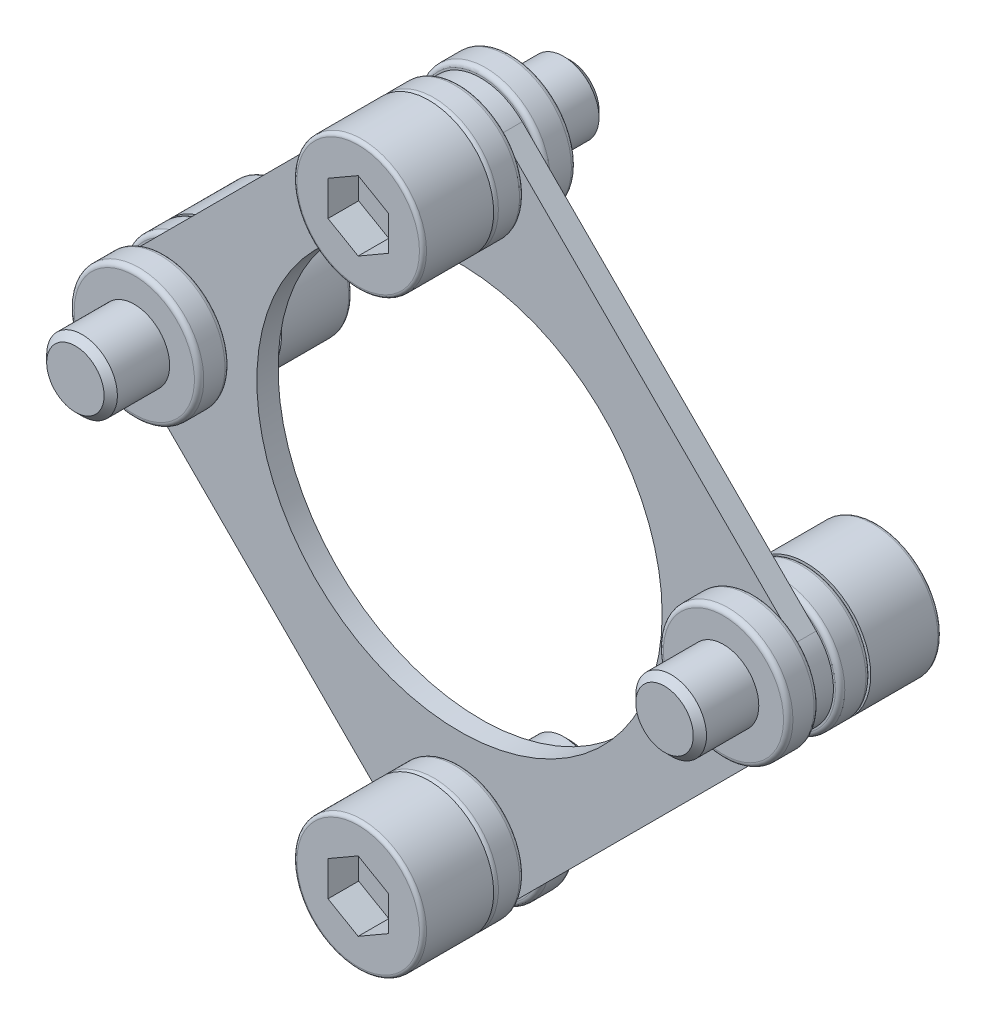
from build123d import *

# Parameters (mm, degrees)
SKETCH1_R           = 16
SKETCH1_R_2         = 8.6
BOSS_EXTRUDE1_DEPTH = 0.9
SKETCH7_OUTSIDE_W   = 43.052
SKETCH7_OUTSIDE_H   = 43.052
CUT_EXTRUDE14_DEPTH = 23.645308565
CUT_EXTRUDE1_DEPTH  = 1.3
CUT_EXTRUDE2_DEPTH  = 1.3
CIRPATTERN1_COUNT   = 2


with BuildPart() as part:
    # Sketch1 → Boss-Extrude1 (new body)
    with BuildSketch(Plane.XY):
        Circle(SKETCH1_R)
        Circle(SKETCH1_R_2, mode=Mode.SUBTRACT)
    extrude(amount=BOSS_EXTRUDE1_DEPTH)

    # Sketch7 outside → Cut-Extrude14 (cut, through all)
    with BuildSketch(Plane.XY):
        Rectangle(SKETCH7_OUTSIDE_W, SKETCH7_OUTSIDE_H)
        with BuildLine():
            Line((-1.761402992, 14.238302146), (-14.238302146, 1.761402992))
            ThreePointArc((-14.238302146, 1.761402992), (-14.967899154, 0), (-14.238302146, -1.761402992))
            Line((-14.238302146, -1.761402992), (-1.761402992, -14.238302146))
            ThreePointArc((-1.761402992, -14.238302146), (0, -14.967899154), (1.761402992, -14.238302146))
            Line((1.761402992, -14.238302146), (14.238302146, -1.761402992))
            ThreePointArc((14.238302146, -1.761402992), (14.967899154, 0), (14.238302146, 1.761402992))
            Line((14.238302146, 1.761402992), (1.761402992, 14.238302146))
            ThreePointArc((1.761402992, 14.238302146), (0, 14.967899154), (-1.761402992, 14.238302146))
        make_face(mode=Mode.SUBTRACT)
    extrude(amount=CUT_EXTRUDE14_DEPTH, mode=Mode.SUBTRACT)

    # Sketch2 → Revolve1 (revolve)
    with BuildSketch(Plane.ZY, mode=Mode.PRIVATE) as revolve1_sk:
        with BuildLine():
            Line((5.2, 12.5), (5.2, 15.1))
            ThreePointArc((5.2, 15.1), (5.156066017, 15.206066017), (5.05, 15.25))
            Line((5.05, 15.25), (2.2, 15.25))
            Line((2.2, 15.25), (2.2, 15.05))
            ThreePointArc((2.2, 15.05), (2.141421356, 15.191421356), (2, 15.25))
            Line((2, 15.25), (1.1, 15.25))
            ThreePointArc((1.1, 15.25), (0.958578644, 15.191421356), (0.9, 15.05))
            Line((0.9, 15.05), (0.9, 12.5))
            Line((0.9, 12.5), (5.2, 12.5))
        make_face()
        with BuildLine():
            Line((-3.519, 14), (-3.8, 13.719))
            Line((-3.8, 13.719), (-3.8, 12.5))
            Line((-3.8, 12.5), (0, 12.5))
            Line((0, 12.5), (0, 15.05))
            ThreePointArc((0, 15.05), (-0.058578644, 15.191421356), (-0.2, 15.25))
            Line((-0.2, 15.25), (-1.1, 15.25))
            ThreePointArc((-1.1, 15.25), (-1.241421356, 15.191421356), (-1.3, 15.05))
            Line((-1.3, 15.05), (-1.3, 14))
            Line((-1.3, 14), (-3.519, 14))
        make_face()
    revolve1 = revolve(revolve1_sk.sketch.rotate(Axis((0, 12.5, 5.2), (0, 0, -1)), 90), axis=Axis((0, 12.5, 5.2), (0, 0, -1)))

    # Sketch3 → Cut-Extrude1 (cut)
    with BuildSketch(Plane.XY.offset(5.2)):
        Polygon((0, 13.978016689), (-1.28, 13.239008345), (-1.28, 11.760991655), (0, 11.021983311), (1.28, 11.760991655), (1.28, 13.239008345), align=None)
    cut_extrude1 = extrude(amount=-CUT_EXTRUDE1_DEPTH, mode=Mode.SUBTRACT)

    # Sketch4 → Revolve2 (revolve)
    with BuildSketch(Plane(origin=(0, 0, 0), x_dir=(0, 0, 1), z_dir=(0, -1, 0))):
        with BuildLine():
            Line((-4.3, 12.5), (-4.3, 15.1))
            ThreePointArc((-4.3, 15.1), (-4.256066017, 15.206066017), (-4.15, 15.25))
            Line((-4.15, 15.25), (-1.3, 15.25))
            Line((-1.3, 15.25), (-1.3, 15.05))
            ThreePointArc((-1.3, 15.05), (-1.241421356, 15.191421356), (-1.1, 15.25))
            Line((-1.1, 15.25), (-0.2, 15.25))
            ThreePointArc((-0.2, 15.25), (-0.058578644, 15.191421356), (0, 15.05))
            Line((0, 15.05), (0, 12.5))
            Line((0, 12.5), (-4.3, 12.5))
        make_face()
        with BuildLine():
            Line((4.7, 12.5), (0.9, 12.5))
            Line((0.9, 12.5), (0.9, 15.05))
            ThreePointArc((0.9, 15.05), (0.958578644, 15.191421356), (1.1, 15.25))
            Line((1.1, 15.25), (2, 15.25))
            ThreePointArc((2, 15.25), (2.141421356, 15.191421356), (2.2, 15.05))
            Line((2.2, 15.05), (2.2, 14))
            Line((2.2, 14), (4.419, 14))
            Line((4.419, 14), (4.7, 13.719))
            Line((4.7, 13.719), (4.7, 12.5))
        make_face()
    revolve2 = revolve(axis=Axis((-12.5, 0, -4.3), (0, 0, 1)))

    # Sketch5 → Cut-Extrude2 (cut)
    with BuildSketch(Plane(origin=(0, 0, -4.3), x_dir=(-1, 0, 0), z_dir=(0, 0, -1))):
        Polygon((12.5, 1.478016689), (11.22, 0.739008345), (11.22, -0.739008345), (12.5, -1.478016689), (13.78, -0.739008345), (13.78, 0.739008345), align=None)
    cut_extrude2 = extrude(amount=-CUT_EXTRUDE2_DEPTH, mode=Mode.SUBTRACT)

    # CirPattern1: Revolve1, Cut-Extrude1, Revolve2, Cut-Extrude2 ×2 about axis
    cirpattern1_axis = Axis((0, 0, 0), (0, 0, 1))
    add([revolve1.rotate(cirpattern1_axis, i * 360 / CIRPATTERN1_COUNT) for i in range(1, CIRPATTERN1_COUNT)])
    add([cut_extrude1.rotate(cirpattern1_axis, i * 360 / CIRPATTERN1_COUNT) for i in range(1, CIRPATTERN1_COUNT)], mode=Mode.SUBTRACT)
    add([revolve2.rotate(cirpattern1_axis, i * 360 / CIRPATTERN1_COUNT) for i in range(1, CIRPATTERN1_COUNT)])
    add([cut_extrude2.rotate(cirpattern1_axis, i * 360 / CIRPATTERN1_COUNT) for i in range(1, CIRPATTERN1_COUNT)], mode=Mode.SUBTRACT)


solid = part.part
